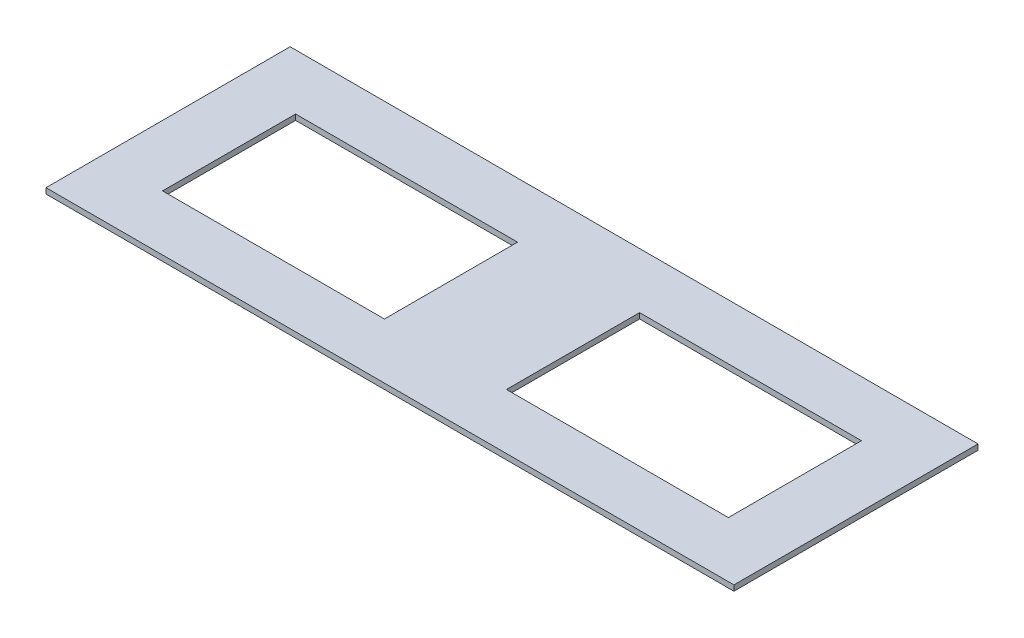
from build123d import *

# Parameters (mm, degrees)
SKETCH1_W           = 1574.8
SKETCH1_H           = 558.8
SKETCH1_W_2         = 508
SKETCH1_H_2         = 304.8
BOSS_EXTRUDE1_DEPTH = 12.7


with BuildPart() as part:
    # Sketch1 → Boss-Extrude1 (new body)
    with BuildSketch(Plane(origin=(0, 0, 0), x_dir=(1, 0, 0), z_dir=(0, 1, 0))):
        Rectangle(SKETCH1_W, SKETCH1_H)
        with Locations((-393.7, 0)):
            Rectangle(SKETCH1_W_2, SKETCH1_H_2, mode=Mode.SUBTRACT)
        with Locations((393.7, 0)):
            Rectangle(SKETCH1_W_2, SKETCH1_H_2, mode=Mode.SUBTRACT)
    extrude(amount=BOSS_EXTRUDE1_DEPTH)


solid = part.part
